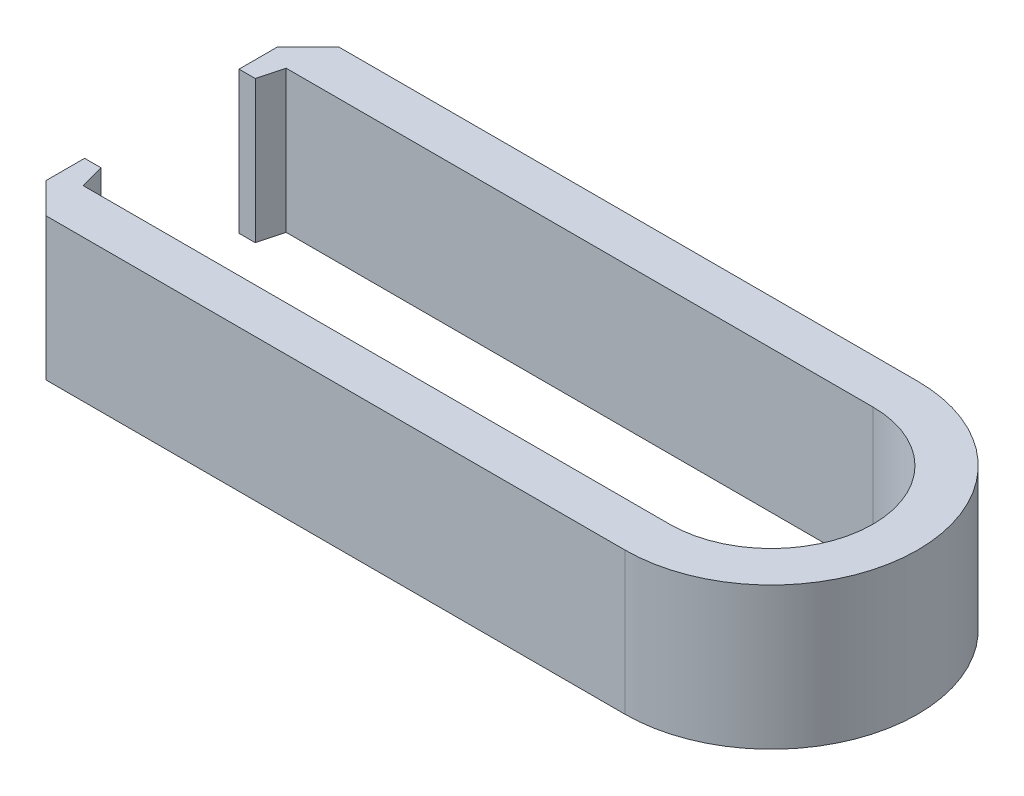
from build123d import *

# Parameters (mm, degrees)
BOSS_EXTRUDE1_DEPTH = 7
CHAMFER1_SIZE       = 1.5


with BuildPart() as part:
    # Sketch1 → Boss-Extrude1 (new body)
    with BuildSketch(Plane(origin=(0, 0, 0), x_dir=(1, 0, 0), z_dir=(0, 1, 0))):
        with BuildLine():
            Line((-29.2, 3.8), (-28.878460969, 5))
            Line((-28.878460969, 5), (0, 5))
            ThreePointArc((0, 5), (5, 0), (0, -5))
            Line((0, -5), (-28.878460969, -5))
            Line((-28.878460969, -5), (-29.2, -3.8))
            Line((-29.2, -3.8), (-30, -3.8))
            Line((-30, -3.8), (-30, -7.2))
            Line((-30, -7.2), (0, -7.2))
            ThreePointArc((0, -7.2), (7.2, 0), (0, 7.2))
            Line((0, 7.2), (-30, 7.2))
            Line((-30, 7.2), (-30, 3.8))
            Line((-30, 3.8), (-29.2, 3.8))
        make_face()
    extrude(amount=BOSS_EXTRUDE1_DEPTH)

    # Chamfer1
    chamfer1_edges = [part.edges().sort_by_distance(p)[0] for p in [
        (-30, 3.5, -7.2),
        (-30, 3.5, 7.2),
    ]]
    chamfer(chamfer1_edges, length=CHAMFER1_SIZE)


solid = part.part
